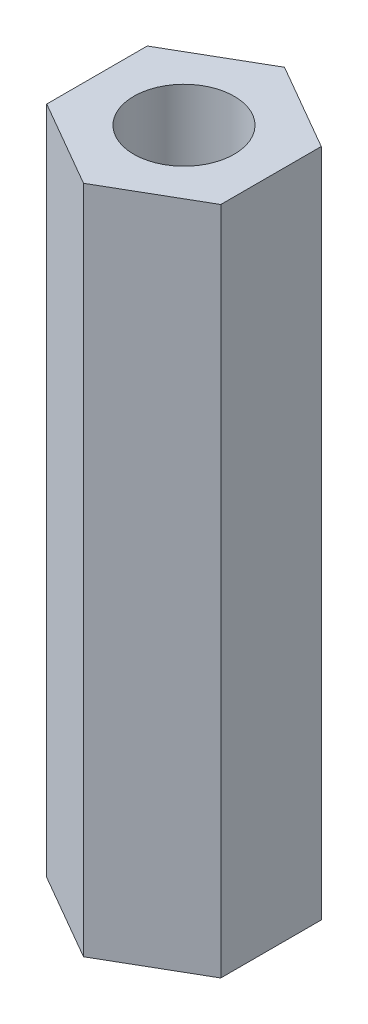
from build123d import *

# Parameters (mm, degrees)
SKETCH_1_R      = 1.5
EXTRUDE_1_DEPTH = 20


with BuildPart() as part:
    # Эскиз1 → Бобышка-Вытянуть1 (new body)
    with BuildSketch(Plane(origin=(0, 0, 0), x_dir=(1, 0, 0), z_dir=(0, 1, 0))):
        Polygon((-2.598076211, -1.5), (0, -3), (2.598076211, -1.5), (2.598076211, 1.5), (0, 3), (-2.598076211, 1.5), align=None)
        with Locations(Location((0, 0, 0), (0, 0, 270))):
            Circle(SKETCH_1_R, mode=Mode.SUBTRACT)
    extrude(amount=EXTRUDE_1_DEPTH)


solid = part.part
